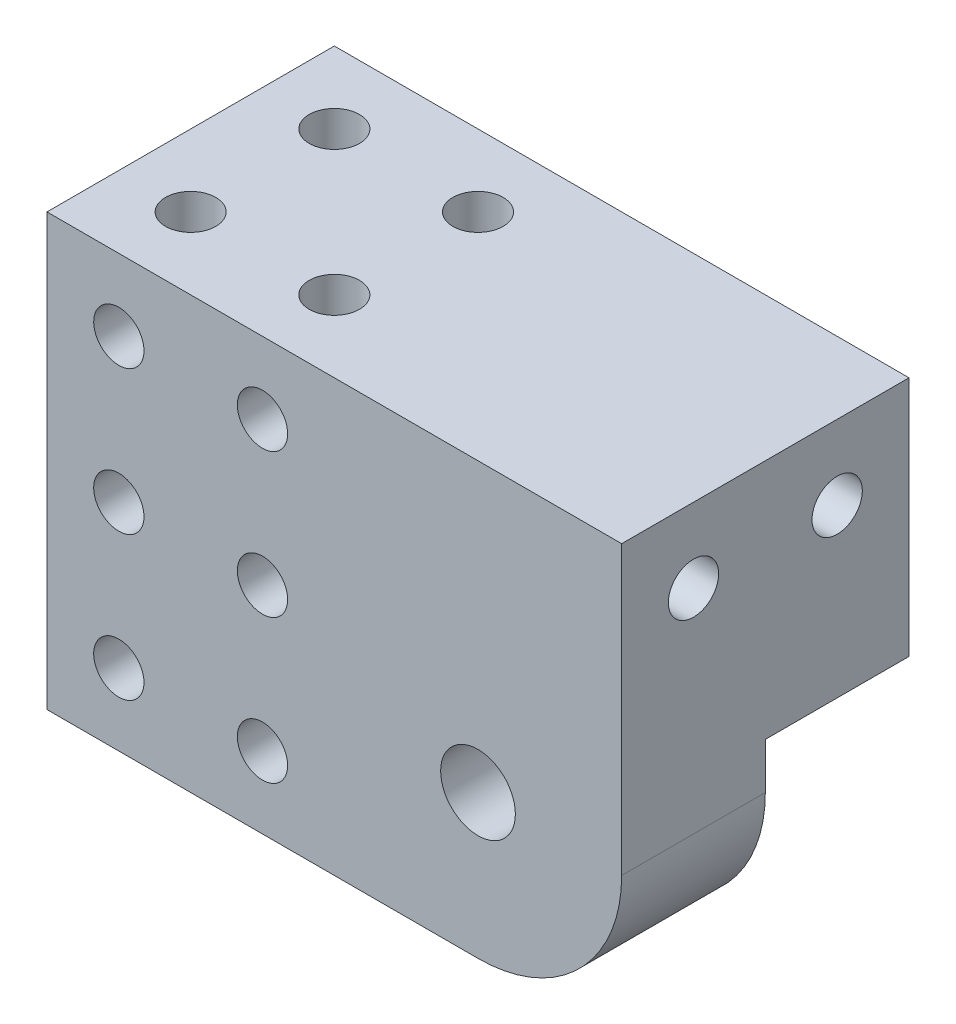
from build123d import *

# Parameters (mm, degrees)
ESQUISSE1_R             = 1.75
ESQUISSE1_R_2           = 2.6
BOSS_EXTRU_1_DEPTH      = 20
ESQUISSE2_R             = 1.75
ENL_V_MAT_EXTRU_1_DEPTH = 54.851648071
ESQUISSE3_R             = 10.5
ENL_V_MAT_EXTRU_2_DEPTH = 10
ESQUISSE4_R             = 1.75
ENL_V_MAT_EXTRU_3_DEPTH = 54.851648071
CHANFREIN1_SIZE         = 1.5


with BuildPart() as part:
    # Esquisse1 → Boss.-Extru.1 (new body)
    with BuildSketch(Plane.XY):
        with BuildLine():
            Line((0, 0), (0, 30))
            Line((0, 30), (30, 30))
            Line((30, 30), (40, 30))
            Line((40, 30), (40, 10))
            ThreePointArc((40, 10), (37.071067812, 2.928932188), (30, 0))
            Line((30, 0), (0, 0))
        make_face()
        with Locations((5, 5)):
            Circle(ESQUISSE1_R, mode=Mode.SUBTRACT)
        with Locations((5, 25)):
            Circle(ESQUISSE1_R, mode=Mode.SUBTRACT)
        with Locations((5, 15)):
            Circle(ESQUISSE1_R, mode=Mode.SUBTRACT)
        with Locations((15, 15)):
            Circle(ESQUISSE1_R, mode=Mode.SUBTRACT)
        with Locations((15, 25)):
            Circle(ESQUISSE1_R, mode=Mode.SUBTRACT)
        with Locations((15, 5)):
            Circle(ESQUISSE1_R, mode=Mode.SUBTRACT)
        with Locations((30, 10)):
            Circle(ESQUISSE1_R_2, mode=Mode.SUBTRACT)
    extrude(amount=BOSS_EXTRU_1_DEPTH)

    # Esquisse2 → Enlèv. mat.-Extru.1 (cut, through all)
    with BuildSketch(Plane(origin=(0, 0, 0), x_dir=(-1, 0, 0), z_dir=(0, -1, 0))):
        with Locations(Location((-5, -15, 0), (0, 0, 180))):
            Circle(ESQUISSE2_R)
        with Locations(Location((-5, -5, 0), (0, 0, 180))):
            Circle(ESQUISSE2_R)
        with Locations(Location((-15, -5, 0), (0, 0, 180))):
            Circle(ESQUISSE2_R)
        with Locations(Location((-15, -15, 0), (0, 0, 180))):
            Circle(ESQUISSE2_R)
    extrude(amount=-ENL_V_MAT_EXTRU_1_DEPTH, mode=Mode.SUBTRACT)

    # Esquisse3 → Enlèv. mat.-Extru.2 (cut)
    with BuildSketch(Plane(origin=(0, 0, 0), x_dir=(-1, 0, 0), z_dir=(0, 0, -1))):
        with Locations((-30, 10)):
            Circle(ESQUISSE3_R)
    extrude(amount=-ENL_V_MAT_EXTRU_2_DEPTH, mode=Mode.SUBTRACT)

    # Esquisse4 → Enlèv. mat.-Extru.3 (cut, through all)
    with BuildSketch(Plane.ZY):
        with Locations(Location((15, 24.817963413, 0), (0, 0, 319.218136699))):
            Circle(ESQUISSE4_R)
        with Locations(Location((5, 24.817963413, 0), (0, 0, 49.218136699))):
            Circle(ESQUISSE4_R)
    extrude(amount=-ENL_V_MAT_EXTRU_3_DEPTH, mode=Mode.SUBTRACT)

    # Chanfrein1
    chanfrein1_edges = [part.edges().sort_by_distance(p)[0] for p in [
        (27.4, 10, 10),
    ]]
    chamfer(chanfrein1_edges, length=CHANFREIN1_SIZE)


solid = part.part
